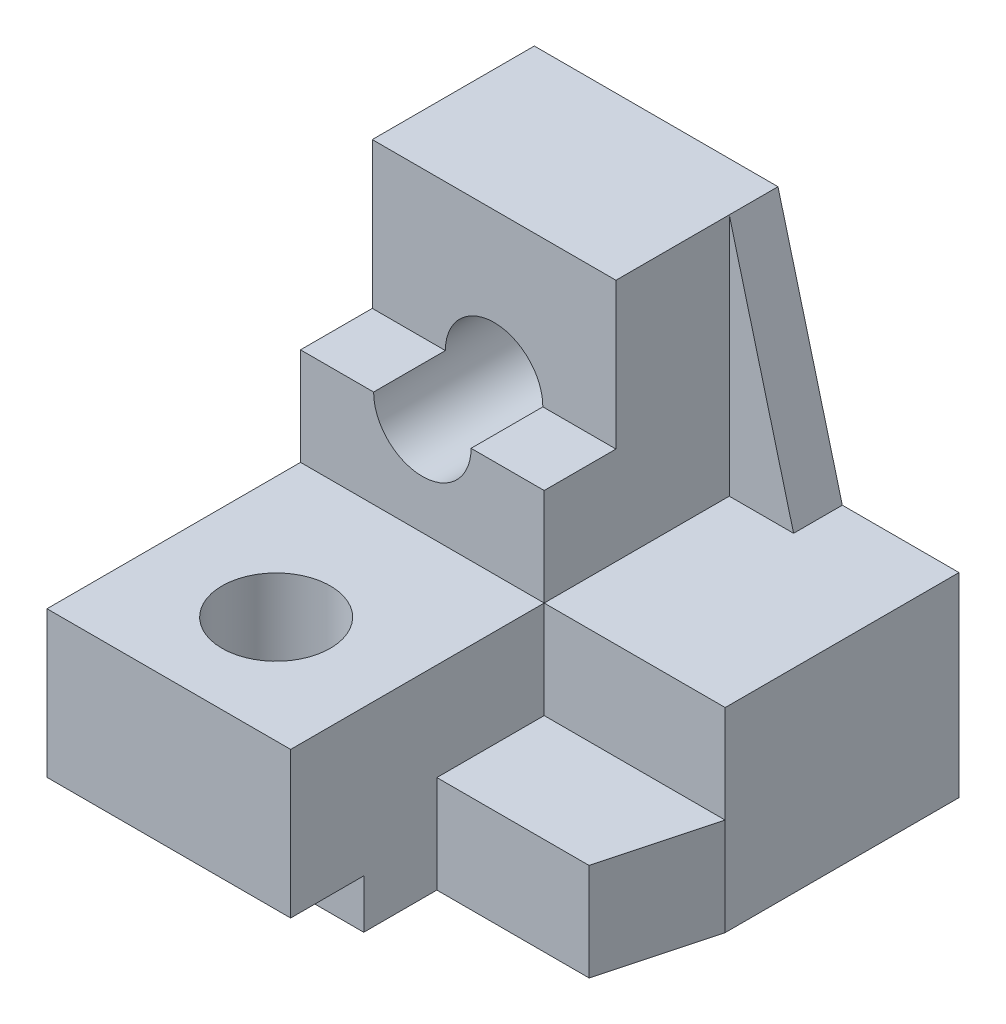
from build123d import *
from build123d.topology import SkipClean

# Parameters (mm, degrees)
CROQUIS1_W               = 100
CROQUIS1_H               = 100
SALIENTE_EXTRUIR1_DEPTH  = 20
CROQUIS2_W               = 50
CROQUIS2_H               = 52.022123513
SALIENTE_EXTRUIR2_DEPTH  = 20
CROQUIS6_W               = 50
CROQUIS6_H               = 30
CORTAR_EXTRUIR1_DEPTH    = 20
CROQUIS9_W               = 15
CROQUIS9_H               = 10.032008702
CORTAR_EXTRUIR8_DEPTH    = 50
CROQUIS10_R              = 11.107626401
CORTAR_EXTRUIR9_DEPTH    = 20
CORTAR_EXTRUIR11_DEPTH   = 20
CROQUIS14_W              = 87.144366741
CROQUIS14_H              = 47.977876487
SALIENTE_EXTRUIR4_DEPTH  = 20
CORTAR_EXTRUIR12_DEPTH   = 20
CROQUIS16_W              = 50
CROQUIS16_H              = 47.977876487
SALIENTE_EXTRUIR5_DEPTH  = 20
CORTAR_EXTRUIR13_DEPTH   = 94.841895413
CROQUIS22_W              = 50
CROQUIS22_H              = 33.250287406
SALIENTE_EXTRUIR6_DEPTH  = 20
CORTAR_EXTRUIR14_DEPTH   = 116.566102865
CROQUIS25_W              = 50
CROQUIS25_H              = 33.250287406
SALIENTE_EXTRUIR7_DEPTH  = 10
SALIENTE_EXTRUIR10_DEPTH = 10


with BuildPart() as part:
    # Croquis1 → Saliente-Extruir1 (new body)
    with BuildSketch(Plane(origin=(0, 0, 0), x_dir=(1, 0, 0), z_dir=(0, 1, 0))):
        Rectangle(CROQUIS1_W, CROQUIS1_H)
    extrude(amount=SALIENTE_EXTRUIR1_DEPTH)

    # Croquis2 → Saliente-Extruir2 (add)
    with BuildSketch(Plane(origin=(0, 20, 0), x_dir=(1, 0, 0), z_dir=(0, 1, 0))):
        with Locations((-25, -23.988938244)):
            Rectangle(CROQUIS2_W, CROQUIS2_H)
    extrude(amount=SALIENTE_EXTRUIR2_DEPTH)

    # Croquis6 → Cortar-Extruir1 (cut)
    with BuildSketch(Plane(origin=(0, 20, 0), x_dir=(1, 0, 0), z_dir=(0, 1, 0))):
        with Locations((25, -35)):
            Rectangle(CROQUIS6_W, CROQUIS6_H)
    extrude(amount=-CORTAR_EXTRUIR1_DEPTH, mode=Mode.SUBTRACT)

    # Croquis9 → Cortar-Extruir8 (cut)
    with BuildSketch(Plane(origin=(0, 0, 0), x_dir=(0, 0, -1), z_dir=(1, 0, 0))):
        with Locations((-42.5, 5.016004351)):
            Rectangle(CROQUIS9_W, CROQUIS9_H)
    extrude(amount=-CORTAR_EXTRUIR8_DEPTH, mode=Mode.SUBTRACT)

    # Croquis10 → Cortar-Extruir9 (cut)
    with BuildSketch(Plane(origin=(0, 40, 0), x_dir=(1, 0, 0), z_dir=(0, 1, 0))):
        with Locations(Location((-25, -27.977876487, 0), (0, 0, 270))):
            Circle(CROQUIS10_R)
    extrude(amount=-CORTAR_EXTRUIR9_DEPTH, mode=Mode.SUBTRACT)

    # Croquis12 → Cortar-Extruir11 (cut)
    with BuildSketch(Plane(origin=(0, 20, 0), x_dir=(1, 0, 0), z_dir=(0, 1, 0))):
        Polygon((50, 50), (31.24355653, -20), (50, -20), align=None)
    extrude(amount=-CORTAR_EXTRUIR11_DEPTH, mode=Mode.SUBTRACT)

    # Croquis14 → Saliente-Extruir4 (add)
    with BuildSketch(Plane(origin=(0, 20, 0), x_dir=(1, 0, 0), z_dir=(0, 1, 0))):
        with Locations((-6.42781663, 26.011061756)):
            Rectangle(CROQUIS14_W, CROQUIS14_H)
    extrude(amount=SALIENTE_EXTRUIR4_DEPTH)

    # Croquis15 → Cortar-Extruir12 (cut)
    with BuildSketch(Plane(origin=(0, 20, 0), x_dir=(1, 0, 0), z_dir=(0, 1, 0))):
        Polygon((37.144366741, 50), (37.144366741, 2.022123513), (50, 50), align=None)
    extrude(amount=-CORTAR_EXTRUIR12_DEPTH, mode=Mode.SUBTRACT)

    # Croquis16 → Saliente-Extruir5 (add)
    with BuildSketch(Plane(origin=(0, 40, 0), x_dir=(1, 0, 0), z_dir=(0, 1, 0))):
        with Locations((-25, 26.011061756)):
            Rectangle(CROQUIS16_W, CROQUIS16_H)
    extrude(amount=SALIENTE_EXTRUIR5_DEPTH)

    # Croquis19 → Cortar-Extruir13 (cut, through all)
    with BuildSketch(Plane.XY.offset(-2.022123513)):
        with BuildLine():
            Line((-35, 60), (-15, 60))
            ThreePointArc((-15, 60), (-25, 50), (-35, 60))
        make_face()
    extrude(amount=-CORTAR_EXTRUIR13_DEPTH, mode=Mode.SUBTRACT)

    # Croquis22 → Saliente-Extruir6 (add)
    with BuildSketch(Plane(origin=(0, 60, 0), x_dir=(1, 0, 0), z_dir=(0, 1, 0))):
        with Locations((-25, 33.374856297)):
            Rectangle(CROQUIS22_W, CROQUIS22_H)
    extrude(amount=SALIENTE_EXTRUIR6_DEPTH)

    # Croquis23 → Cortar-Extruir14 (cut, through all)
    with SkipClean():  # the faces are left unmerged after this step: merging them gives an invalid solid
        with BuildSketch(Plane.XY.offset(-16.749712594)):
            with BuildLine():
                Line((-35, 60), (-15, 60))
                ThreePointArc((-15, 60), (-25, 70), (-35, 60))
            make_face()
        extrude(amount=-CORTAR_EXTRUIR14_DEPTH, mode=Mode.SUBTRACT)

    # Croquis25 → Saliente-Extruir7 (add)
    with SkipClean():  # the faces are left unmerged after this step: merging them gives an invalid solid
        with BuildSketch(Plane(origin=(0, 80, 0), x_dir=(1, 0, 0), z_dir=(0, 1, 0))):
            with Locations((-25, 33.374856297)):
                Rectangle(CROQUIS25_W, CROQUIS25_H)
        extrude(amount=SALIENTE_EXTRUIR7_DEPTH)

    # Croquis29 → Saliente-Extruir10 (add)
    with SkipClean():  # the faces are left unmerged after this step: merging them gives an invalid solid
        with BuildSketch(Plane(origin=(0, 0, -50), x_dir=(-1, 0, 0), z_dir=(0, 0, -1))):
            Polygon((0, 90), (-13.201421023, 40), (0, 40), (0.141328754, 40.445503682), align=None)
        extrude(amount=-SALIENTE_EXTRUIR10_DEPTH)


solid = part.part
